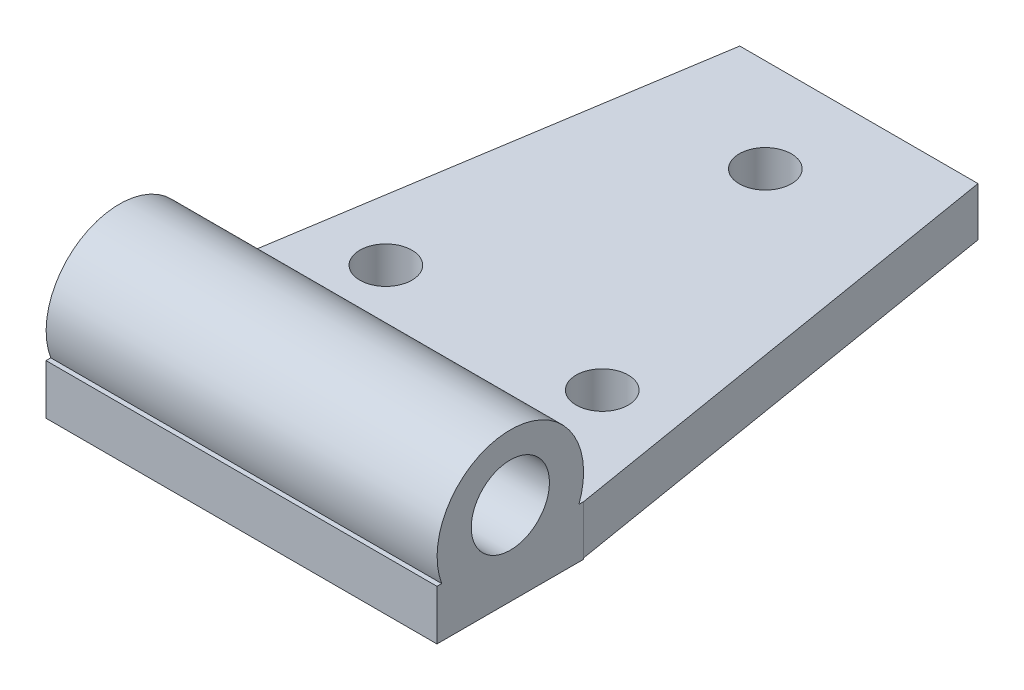
from build123d import *

# Parameters (mm, degrees)
BOSS_EXTRUDE1_DEPTH = 4.7498
SKETCH2_R           = 2.54
CUT_EXTRUDE1_DEPTH  = 4.7498
SKETCH3_W           = 38.1
SKETCH3_H           = 4.866954954
BOSS_EXTRUDE2_DEPTH = 14.3002
SKETCH4_R           = 7.1374
BOSS_EXTRUDE3_DEPTH = 38.1
SKETCH5_R           = 3.81
CUT_EXTRUDE2_DEPTH  = 43.2562


with BuildPart() as part:
    # Sketch1 → Boss-Extrude1 (new body)
    with BuildSketch(Plane(origin=(0, 0, 0), x_dir=(1, 0, 0), z_dir=(0, 1, 0))):
        Polygon((0, 0), (38.1, 0), (30.471493689, 46.0502), (7.255893689, 46.0502), align=None)
    extrude(amount=BOSS_EXTRUDE1_DEPTH)

    # Sketch2 → Cut-Extrude1 (cut)
    with BuildSketch(Plane(origin=(0, 4.7498, 0), x_dir=(1, 0, 0), z_dir=(0, 1, 0))):
        with Locations(Location((18.863693689, 36.9316, 0), (0, 0, 270))):
            Circle(SKETCH2_R)
        with Locations(Location((8.509, 10.3124, 0), (0, 0, 270))):
            Circle(SKETCH2_R)
        with Locations(Location((29.591, 10.3124, 0), (0, 0, 270))):
            Circle(SKETCH2_R)
    extrude(amount=-CUT_EXTRUDE1_DEPTH, mode=Mode.SUBTRACT)

    # Sketch3 → Boss-Extrude2 (add)
    with BuildSketch(Plane.XY):
        with Locations((19.05, 2.316322523)):
            Rectangle(SKETCH3_W, SKETCH3_H)
    extrude(amount=BOSS_EXTRUDE2_DEPTH)

    # Sketch4 → Boss-Extrude3 (add)
    with BuildSketch(Plane(origin=(38.1, 0, 0), x_dir=(0, 0, -1), z_dir=(1, 0, 0))):
        with Locations((-7.1501, 7.248845046)):
            Circle(SKETCH4_R)
    extrude(amount=-BOSS_EXTRUDE3_DEPTH)

    # Sketch5 → Cut-Extrude2 (cut)
    with BuildSketch(Plane(origin=(38.1, 0, 0), x_dir=(0, 0, -1), z_dir=(1, 0, 0))):
        with Locations((-7.1501, 8.036245046)):
            Circle(SKETCH5_R)
    extrude(amount=-CUT_EXTRUDE2_DEPTH, mode=Mode.SUBTRACT)


solid = part.part
